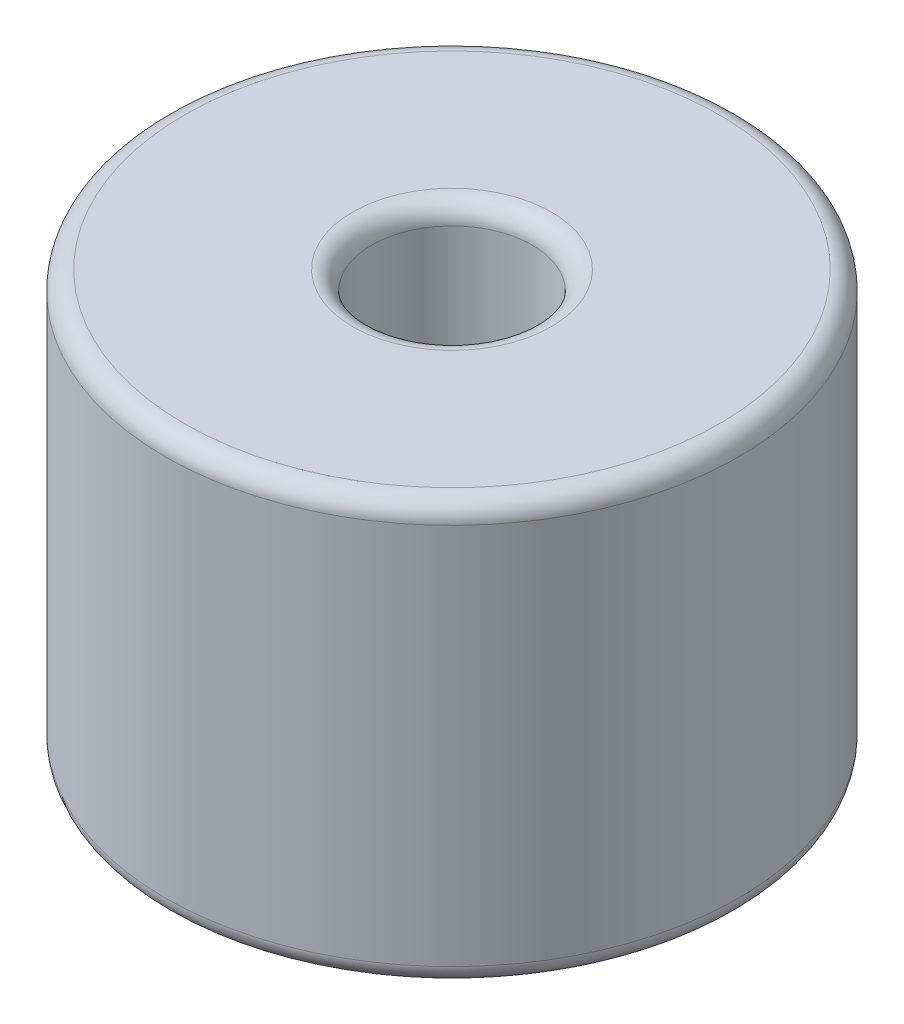
from build123d import *

# Parameters (mm, degrees)
SKETCH1_R           = 7.5
SKETCH1_R_2         = 2.1
BOSS_EXTRUDE1_DEPTH = 11
FILLET1_R           = 0.5


with BuildPart() as part:
    # Sketch1 → Boss-Extrude1 (new body)
    with BuildSketch(Plane(origin=(0, 0, 0), x_dir=(1, 0, 0), z_dir=(0, 1, 0))):
        with Locations(Location((0, 0, 0), (0, 0, 270))):
            Circle(SKETCH1_R)
        with Locations(Location((0, 0, 0), (0, 0, 270))):
            Circle(SKETCH1_R_2, mode=Mode.SUBTRACT)
    extrude(amount=BOSS_EXTRUDE1_DEPTH)

    # Fillet1
    fillet1_edges = [part.edges().sort_by_distance(p)[0] for p in [
        (0, 0, -7.5),
        (0, 11, -7.5),
        (0, 0, -2.1),
        (0, 11, -2.1),
    ]]
    fillet(fillet1_edges, radius=FILLET1_R)


solid = part.part
